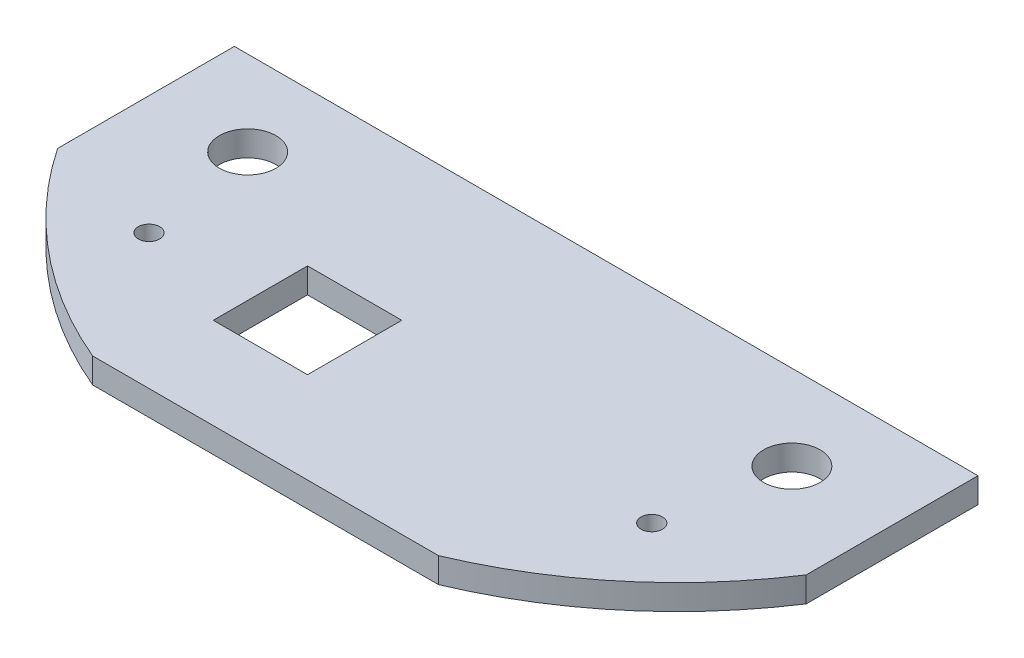
from build123d import *

# Parameters (mm, degrees)
ESQUISSE1_W             = 63
ESQUISSE1_H             = 25
BOSS_EXTRU_1_DEPTH      = 4
D_GAGEMENT_M81_D        = 9
ESQUISSE5_R             = 96
ESQUISSE5_R_2           = 71
ENL_V_MAT_EXTRU_1_DEPTH = 68.845644546
ESQUISSE6_W             = 63
ESQUISSE6_H             = 25
BOSS_EXTRU_2_DEPTH      = 4
ESQUISSE7_W             = 15
ESQUISSE7_H             = 15
ENL_V_MAT_EXTRU_2_DEPTH = 68.845644546
D_GAGEMENT_M31_D        = 3.4


with BuildPart() as part:
    # Esquisse1 → Boss.-Extru.1 (new body)
    with BuildSketch(Plane(origin=(0, 0, 0), x_dir=(1, 0, 0), z_dir=(0, 1, 0))):
        Polygon((-58.901607841, 6.711500167), (-58.901607841, 32.486170288), (59.427941441, 32.486170288), (59.427941441, 7.487213227), (59.427941441, -21.450828615), (-58.901607841, -21.450828615), align=None)
        Rectangle(ESQUISSE1_W, ESQUISSE1_H, mode=Mode.SUBTRACT)
    extrude(amount=BOSS_EXTRU_1_DEPTH)

    # Dégagement M81 (through all)
    with Locations(Plane(origin=(0, 4, 0), x_dir=(1, 0, 0), z_dir=(0, 1, 0))):
        with Locations((-43.3, 19), (43.3, 19)):
            Hole(D_GAGEMENT_M81_D / 2)

    # Esquisse5 → Enlèv. mat.-Extru.1 (cut, through all)
    with BuildSketch(Plane(origin=(0, 4, 0), x_dir=(1, 0, 0), z_dir=(0, 1, 0))):
        with Locations((0, 44.002199903)):
            Circle(ESQUISSE5_R)
        with Locations((0, 44.002199903)):
            Circle(ESQUISSE5_R_2, mode=Mode.SUBTRACT)
    extrude(amount=-ENL_V_MAT_EXTRU_1_DEPTH, mode=Mode.SUBTRACT)

    # Esquisse6 → Boss.-Extru.2 (add)
    with BuildSketch(Plane(origin=(0, 4, 0), x_dir=(1, 0, 0), z_dir=(0, 1, 0))):
        Rectangle(ESQUISSE6_W, ESQUISSE6_H)
    extrude(amount=-BOSS_EXTRU_2_DEPTH)

    # Esquisse7 → Enlèv. mat.-Extru.2 (cut, through all)
    with BuildSketch(Plane(origin=(0, 4, 0), x_dir=(1, 0, 0), z_dir=(0, 1, 0))):
        with Locations((-15.335187954, 0.557700645)):
            Rectangle(ESQUISSE7_W, ESQUISSE7_H)
    extrude(amount=-ENL_V_MAT_EXTRU_2_DEPTH, mode=Mode.SUBTRACT)

    # Dégagement M31 (through all)
    with Locations(Plane(origin=(0, 4, 0), x_dir=(1, 0, 0), z_dir=(0, 1, 0))):
        with Locations((-40, 0), (40, 0)):
            Hole(D_GAGEMENT_M31_D / 2)


solid = part.part
